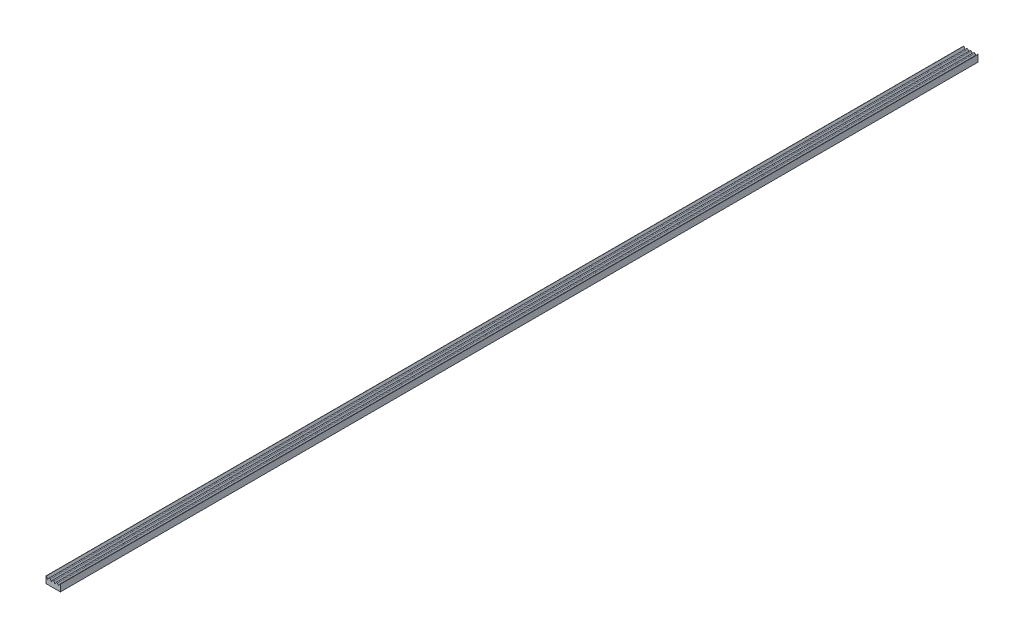
from build123d import *

# Parameters (mm, degrees)
BOSS_EXTRUDE1_DEPTH = 809.625


with BuildPart() as part:
    # Sketch1 → Boss-Extrude1 (new body)
    with BuildSketch(Plane.XY):
        with BuildLine():
            Line((0, 0), (-12.7, 0))
            Line((-12.7, 0), (-12.7, 5.907176879))
            ThreePointArc((-12.7, 5.907176879), (-12.608011679, 6.02925547), (-12.465304215, 5.974486745))
            Line((-12.465304215, 5.974486745), (-11.1125, 3.81))
            Line((-11.1125, 3.81), (-10.063478923, 5.488433723))
            ThreePointArc((-10.063478923, 5.488433723), (-9.525, 5.786884396), (-8.986521077, 5.488433723))
            Line((-8.986521077, 5.488433723), (-7.9375, 3.81))
            Line((-7.9375, 3.81), (-6.888478923, 5.488433723))
            ThreePointArc((-6.888478923, 5.488433723), (-6.35, 5.786884396), (-5.811521077, 5.488433723))
            Line((-5.811521077, 5.488433723), (-4.7625, 3.81))
            Line((-4.7625, 3.81), (-3.713478923, 5.488433723))
            ThreePointArc((-3.713478923, 5.488433723), (-3.175, 5.786884396), (-2.636521077, 5.488433723))
            Line((-2.636521077, 5.488433723), (-1.5875, 3.81))
            Line((-1.5875, 3.81), (-0.234695785, 5.974486745))
            ThreePointArc((-0.234695785, 5.974486745), (-0.091988321, 6.02925547), (0, 5.907176879))
            Line((0, 5.907176879), (0, 0))
        make_face()
    extrude(amount=BOSS_EXTRUDE1_DEPTH)


solid = part.part
